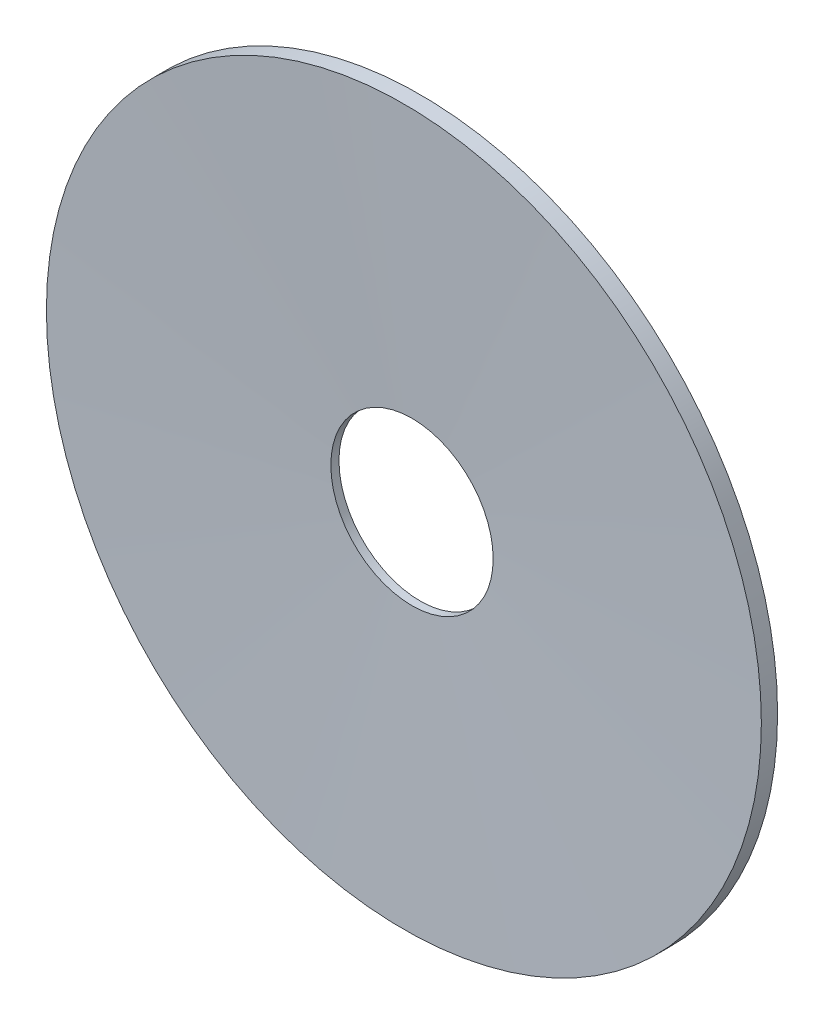
from build123d import *

# Parameters (mm, degrees)
SKETCH2_R           = 88.1
BOSS_EXTRUDE1_DEPTH = 4


with BuildPart() as part:
    # Sketch2 → Boss-Extrude1 (new body)
    with BuildSketch(Plane.XY):
        Circle(SKETCH2_R)
    extrude(amount=BOSS_EXTRUDE1_DEPTH)

    # Sketch4 → Cut-Revolve1 (revolve, cut)
    with BuildSketch(Plane(origin=(0, 0, 0), x_dir=(1, 0, 0), z_dir=(0, 1, 0)), mode=Mode.PRIVATE) as cut_revolve1_sk:
        Polygon((0, -1.804926972), (0, -4), (-88.1, -4), (-20, -2), (-20, 0), (0, 0), align=None)
    revolve(cut_revolve1_sk.sketch.rotate(Axis((0, 0, 1.804926972), (0, 0, 1)), 180), axis=Axis((0, 0, 1.804926972), (0, 0, 1)), mode=Mode.SUBTRACT)


solid = part.part
